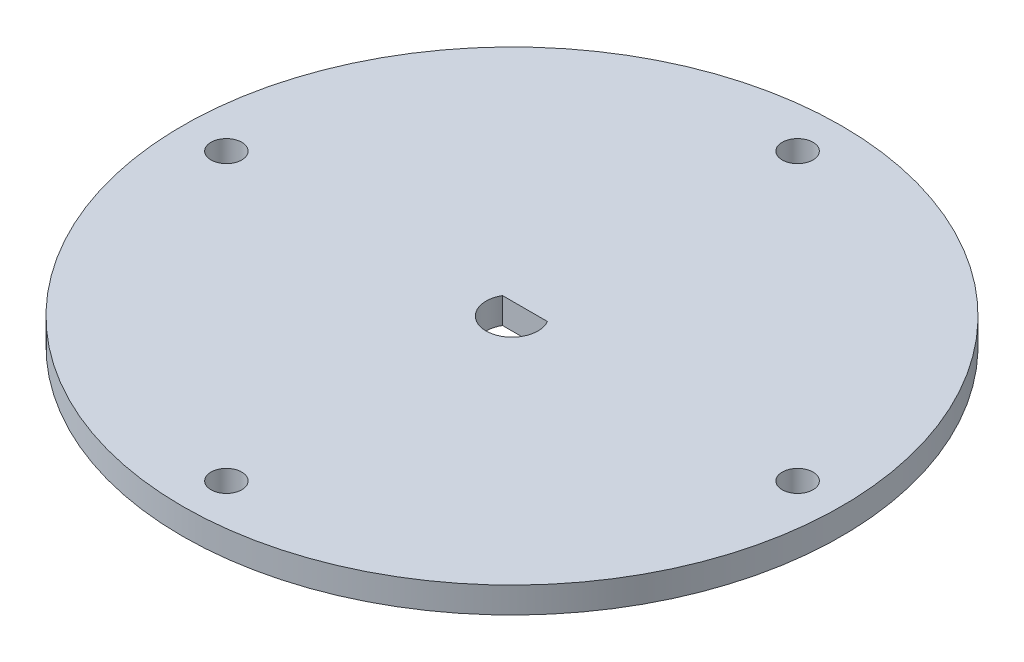
from build123d import *

# Parameters (mm, degrees)
SKETCH1_R           = 38.1
BOSS_EXTRUDE1_DEPTH = 3
SKETCH3_R           = 1.778
CUT_EXTRUDE1_DEPTH  = 54.96498865
CIRPATTERN1_COUNT   = 4
CUT_EXTRUDE2_DEPTH  = 54.96498865


with BuildPart() as part:
    # Sketch1 → Boss-Extrude1 (new body)
    with BuildSketch(Plane(origin=(0, 0, 0), x_dir=(1, 0, 0), z_dir=(0, 1, 0))):
        with Locations(Location((0, 0, 0), (0, 0, 270))):
            Circle(SKETCH1_R)
    extrude(amount=BOSS_EXTRUDE1_DEPTH)

    # Sketch3 → Cut-Extrude1 (cut, through all)
    with BuildSketch(Plane(origin=(0, 3, 0), x_dir=(1, 0, 0), z_dir=(0, 1, 0))):
        with Locations(Location((33.02, 0, 0), (0, 0, 270))):
            Circle(SKETCH3_R)
    cut_extrude1 = extrude(amount=-CUT_EXTRUDE1_DEPTH, mode=Mode.SUBTRACT)

    # CirPattern1: Cut-Extrude1 ×4 about axis
    cirpattern1_axis = Axis((0, 0, 0), (0, 1, 0))
    for i in range(1, CIRPATTERN1_COUNT):
        add(cut_extrude1.rotate(cirpattern1_axis, i * 360 / CIRPATTERN1_COUNT), mode=Mode.SUBTRACT)

    # Sketch4 → Cut-Extrude2 (cut, through all)
    with BuildSketch(Plane(origin=(0, 3, 0), x_dir=(1, 0, 0), z_dir=(0, 1, 0))):
        with BuildLine():
            Line((-2.598076211, 1.5), (2.598076211, 1.5))
            ThreePointArc((2.598076211, 1.5), (0, -3), (-2.598076211, 1.5))
        make_face()
    extrude(amount=-CUT_EXTRUDE2_DEPTH, mode=Mode.SUBTRACT)


solid = part.part
